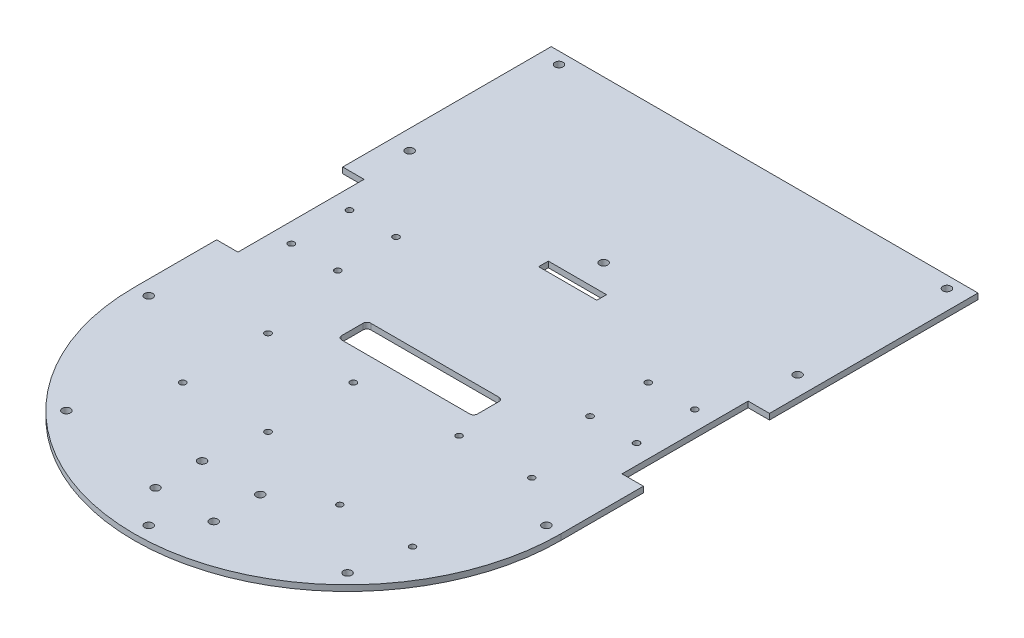
from build123d import *

# Parameters (mm, degrees)
EXTRUDE_1_DEPTH          = 1.5
CUT_EXTRUDE_1_DEPTH      = 179.051256665
CUT_EXTRUDE_1_DEPTH_BACK = 179.051256665
SKETCH_3_R               = 1.6
CUT_EXTRUDE_2_DEPTH      = 179.051256665
CUT_EXTRUDE_2_DEPTH_BACK = 179.051256665
SKETCH_4_W               = 70
SKETCH_4_H               = 15
SKETCH_4_W_2             = 30
SKETCH_4_H_2             = 5
SKETCH_5_R               = 1.6
CUT_EXTRUDE_4_DEPTH      = 179.070210872
FILLET_1_R               = 2
SKETCH_7_R               = 2.1
CUT_EXTRUDE_5_DEPTH      = 179.070210872
SKETCH_8_W               = 28
SKETCH_8_H               = 65
CUT_EXTRUDE_6_DEPTH      = 179.070210872
SKETCH_9_R               = 2.1
CUT_EXTRUDE_7_DEPTH      = 179.070210872
SKETCH_10_R              = 2.1
CUT_EXTRUDE_8_DEPTH      = 10
SKETCH_11_R              = 1.55
CUT_EXTRUDE_9_DEPTH      = 179.070210872
SKETCH_12_W              = 220
SKETCH_12_H              = 75
EXTRUDE_2_DEPTH          = 3
SKETCH_13_R              = 2.1
CUT_EXTRUDE_10_DEPTH     = 242.524325897


with BuildPart() as part:
    # 草图1 → 凸台-拉伸1 (new, symmetric)
    with BuildSketch(Plane(origin=(0, 0, 0), x_dir=(1, 0, 0), z_dir=(0, 1, 0))):
        with BuildLine():
            Line((-110, 0), (-110, 140))
            Line((-110, 140), (110, 140))
            Line((110, 140), (110, 0))
            ThreePointArc((110, 0), (0, -110), (-110, 0))
        make_face()
    extrude(amount=EXTRUDE_1_DEPTH, both=True)

    # 草图3 → 切除-拉伸1 (cut, two sides: drawn at the far end of the back side and taken through both)
    with BuildSketch(Plane(origin=(0, 0, 0), x_dir=(1, 0, 0), z_dir=(0, 1, 0)).offset(-CUT_EXTRUDE_1_DEPTH_BACK)):
        with Locations(Location((65, 90, 0), (0, 0, 270))):
            Circle(SKETCH_3_R)
        with Locations(Location((89, 90, 0), (0, 0, 270))):
            Circle(SKETCH_3_R)
        with Locations(Location((89, 60, 0), (0, 0, 270))):
            Circle(SKETCH_3_R)
        with Locations(Location((65, 60, 0), (0, 0, 270))):
            Circle(SKETCH_3_R)
        with Locations(Location((-65, 60, 0), (0, 0, 90))):
            Circle(SKETCH_3_R)
        with Locations(Location((-89, 60, 0), (0, 0, 90))):
            Circle(SKETCH_3_R)
        with Locations(Location((-89, 90, 0), (0, 0, 90))):
            Circle(SKETCH_3_R)
        with Locations(Location((-65, 90, 0), (0, 0, 90))):
            Circle(SKETCH_3_R)
    extrude(amount=CUT_EXTRUDE_1_DEPTH + CUT_EXTRUDE_1_DEPTH_BACK, mode=Mode.SUBTRACT)

    # 草图4 → 切除-拉伸2 (cut, two sides: drawn at the far end of the back side and taken through both)
    with BuildSketch(Plane(origin=(0, 0, 0), x_dir=(1, 0, 0), z_dir=(0, 1, 0)).offset(-CUT_EXTRUDE_2_DEPTH_BACK)):
        with Locations((0, 37.5)):
            Rectangle(SKETCH_4_W, SKETCH_4_H)
        with Locations((0, 116)):
            Rectangle(SKETCH_4_W_2, SKETCH_4_H_2)
    extrude(amount=CUT_EXTRUDE_2_DEPTH + CUT_EXTRUDE_2_DEPTH_BACK, mode=Mode.SUBTRACT)

    # 草图5 → 切除-拉伸4 (cut, through all)
    with BuildSketch(Plane(origin=(0, 1.5, 0), x_dir=(1, 0, 0), z_dir=(0, 1, 0))):
        with Locations(Location((-55, -30, 0), (0, 0, 270))):
            Circle(SKETCH_5_R)
        with Locations(Location((-11, -30, 0), (0, 0, 270))):
            Circle(SKETCH_5_R)
        with Locations(Location((-11, 14, 0), (0, 0, 270))):
            Circle(SKETCH_5_R)
        with Locations(Location((-55, 14, 0), (0, 0, 270))):
            Circle(SKETCH_5_R)
    extrude(amount=-CUT_EXTRUDE_4_DEPTH, mode=Mode.SUBTRACT)

    # 圆角1
    fillet_1_edges = [part.edges().sort_by_distance(p)[0] for p in [
        (35, 0, -30),
        (35, 0, -45),
        (-35, 0, -45),
        (-35, 0, -30),
    ]]
    fillet(fillet_1_edges, radius=FILLET_1_R)

    # 草图7 → 切除-拉伸5 (cut, through all)
    with BuildSketch(Plane(origin=(0, 1.5, 0), x_dir=(1, 0, 0), z_dir=(0, 1, 0))):
        with Locations(Location((-15, -60, 0), (0, 0, 270))):
            Circle(SKETCH_7_R)
        with Locations(Location((15, -60, 0), (0, 0, 270))):
            Circle(SKETCH_7_R)
        with Locations(Location((15, -84, 0), (0, 0, 270))):
            Circle(SKETCH_7_R)
        with Locations(Location((-15, -84, 0), (0, 0, 270))):
            Circle(SKETCH_7_R)
    extrude(amount=-CUT_EXTRUDE_5_DEPTH, mode=Mode.SUBTRACT)

    # 草图8 → 切除-拉伸6 (cut, through all)
    with BuildSketch(Plane(origin=(0, 1.5, 0), x_dir=(1, 0, 0), z_dir=(0, 1, 0))):
        with Locations((-113, 75)):
            Rectangle(SKETCH_8_W, SKETCH_8_H)
        with Locations((113, 75)):
            Rectangle(SKETCH_8_W, SKETCH_8_H)
    extrude(amount=-CUT_EXTRUDE_6_DEPTH, mode=Mode.SUBTRACT)

    # 草图9 → 切除-拉伸7 (cut, through all)
    with BuildSketch(Plane(origin=(0, 1.5, 0), x_dir=(1, 0, 0), z_dir=(0, 1, 0))):
        with Locations(Location((0, -102.5, 0), (0, 0, 270))):
            Circle(SKETCH_9_R)
        with Locations(Location((-72.478445072, -72.478445072, 0), (0, 0, 270))):
            Circle(SKETCH_9_R)
        with Locations(Location((-102.5, 0, 0), (0, 0, 270))):
            Circle(SKETCH_9_R)
        with Locations(Location((102.5, 0, 0), (0, 0, 270))):
            Circle(SKETCH_9_R)
        with Locations(Location((72.478445072, -72.478445072, 0), (0, 0, 270))):
            Circle(SKETCH_9_R)
    extrude(amount=-CUT_EXTRUDE_7_DEPTH, mode=Mode.SUBTRACT)

    # 草图10 → 切除-拉伸8 (cut)
    with BuildSketch(Plane(origin=(0, 1.5, 0), x_dir=(1, 0, 0), z_dir=(0, 1, 0))):
        with Locations(Location((-100, 132, 0), (0, 0, 270))):
            Circle(SKETCH_10_R)
        with Locations(Location((100, 132, 0), (0, 0, 270))):
            Circle(SKETCH_10_R)
        with Locations(Location((0, 132, 0), (0, 0, 270))):
            Circle(SKETCH_10_R)
    extrude(amount=-CUT_EXTRUDE_8_DEPTH, mode=Mode.SUBTRACT)

    # 草图11 → 切除-拉伸9 (cut, through all)
    with BuildSketch(Plane(origin=(0, 1.5, 0), x_dir=(1, 0, 0), z_dir=(0, 1, 0))):
        with Locations(Location((40, -44, 0), (0, 0, 270))):
            Circle(SKETCH_11_R)
        with Locations(Location((77.5, -44, 0), (0, 0, 270))):
            Circle(SKETCH_11_R)
        with Locations(Location((77.5, 17.5, 0), (0, 0, 270))):
            Circle(SKETCH_11_R)
        with Locations(Location((40, 17.5, 0), (0, 0, 270))):
            Circle(SKETCH_11_R)
    extrude(amount=-CUT_EXTRUDE_9_DEPTH, mode=Mode.SUBTRACT)

    # 草图12 → 凸台-拉伸2 (add)
    with BuildSketch(Plane(origin=(0, 1.5, 0), x_dir=(1, 0, 0), z_dir=(0, 1, 0))):
        with Locations((0, 177.5)):
            Rectangle(SKETCH_12_W, SKETCH_12_H)
    extrude(amount=-EXTRUDE_2_DEPTH)

    # 草图13 → 切除-拉伸10 (cut, through all)
    with BuildSketch(Plane(origin=(0, 1.5, 0), x_dir=(1, 0, 0), z_dir=(0, 1, 0))):
        with Locations(Location((100, 209, 0), (0, 0, 270))):
            Circle(SKETCH_13_R)
        with Locations(Location((-100, 209, 0), (0, 0, 90))):
            Circle(SKETCH_13_R)
    extrude(amount=-CUT_EXTRUDE_10_DEPTH, mode=Mode.SUBTRACT)


solid = part.part
